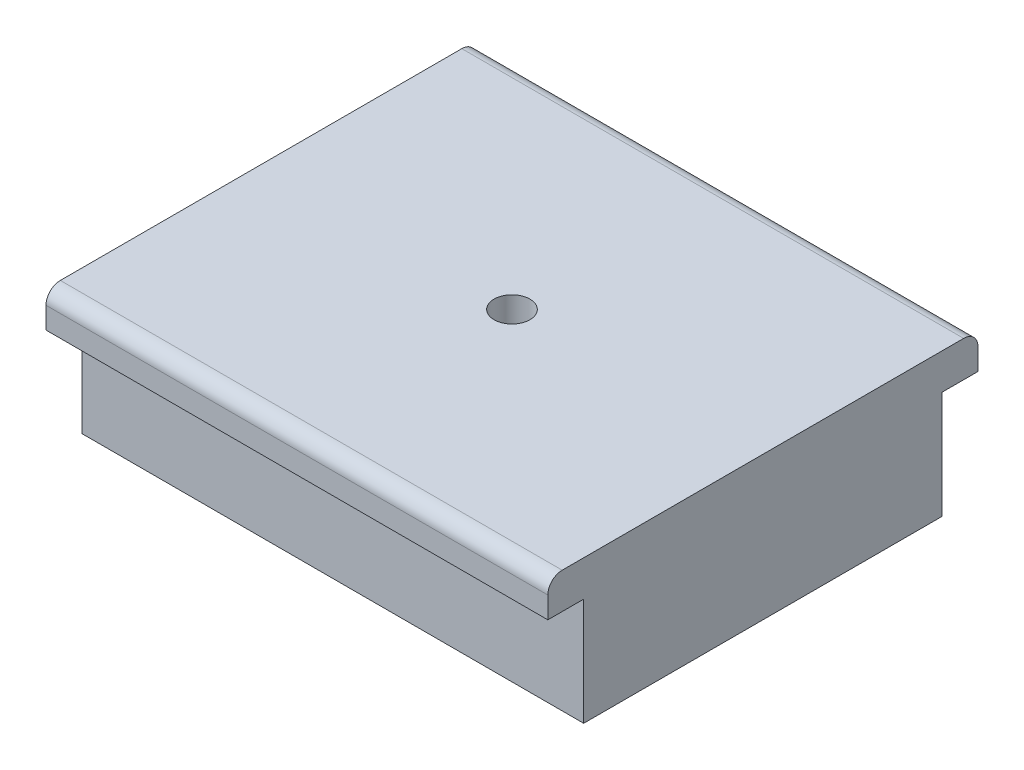
from build123d import *

# Parameters (mm, degrees)
BOSS_EXTRUDE1_DEPTH      = 7.5
BOSS_EXTRUDE1_DEPTH_BACK = 7.5
SKETCH1_W                = 70
SKETCH1_H                = 50
SKETCH2_W                = 70
SKETCH2_H                = 60
BOSS_EXTRUDE2_DEPTH      = 5
FILLET1_R                = 2
SKETCH3_R                = 2.5
CUT_EXTRUDE1_DEPTH       = 10


with BuildPart() as part:
    # Sketch1 → Boss-Extrude1 (new, two sides: drawn at the far end of the back side and taken through both)
    with BuildSketch(Plane(origin=(0, 0, 0), x_dir=(1, 0, 0), z_dir=(0, 1, 0)).offset(-BOSS_EXTRUDE1_DEPTH_BACK)):
        Rectangle(SKETCH1_W, SKETCH1_H)
    extrude(amount=BOSS_EXTRUDE1_DEPTH + BOSS_EXTRUDE1_DEPTH_BACK)

    # Sketch2 → Boss-Extrude2 (add)
    with BuildSketch(Plane(origin=(0, 7.5, 0), x_dir=(1, 0, 0), z_dir=(0, 1, 0))):
        Rectangle(SKETCH2_W, SKETCH2_H)
    extrude(amount=BOSS_EXTRUDE2_DEPTH)

    # Fillet1
    fillet1_edges = [part.edges().sort_by_distance(p)[0] for p in [
        (0, 12.5, -30),
        (0, 12.5, 30),
    ]]
    fillet(fillet1_edges, radius=FILLET1_R)

    # Sketch3 → Cut-Extrude1 (cut)
    with BuildSketch(Plane(origin=(0, 12.5, 0), x_dir=(1, 0, 0), z_dir=(0, 1, 0))):
        with Locations(Location((0, 0, 0), (0, 0, 270))):
            Circle(SKETCH3_R)
    extrude(amount=-CUT_EXTRUDE1_DEPTH, mode=Mode.SUBTRACT)


solid = part.part
